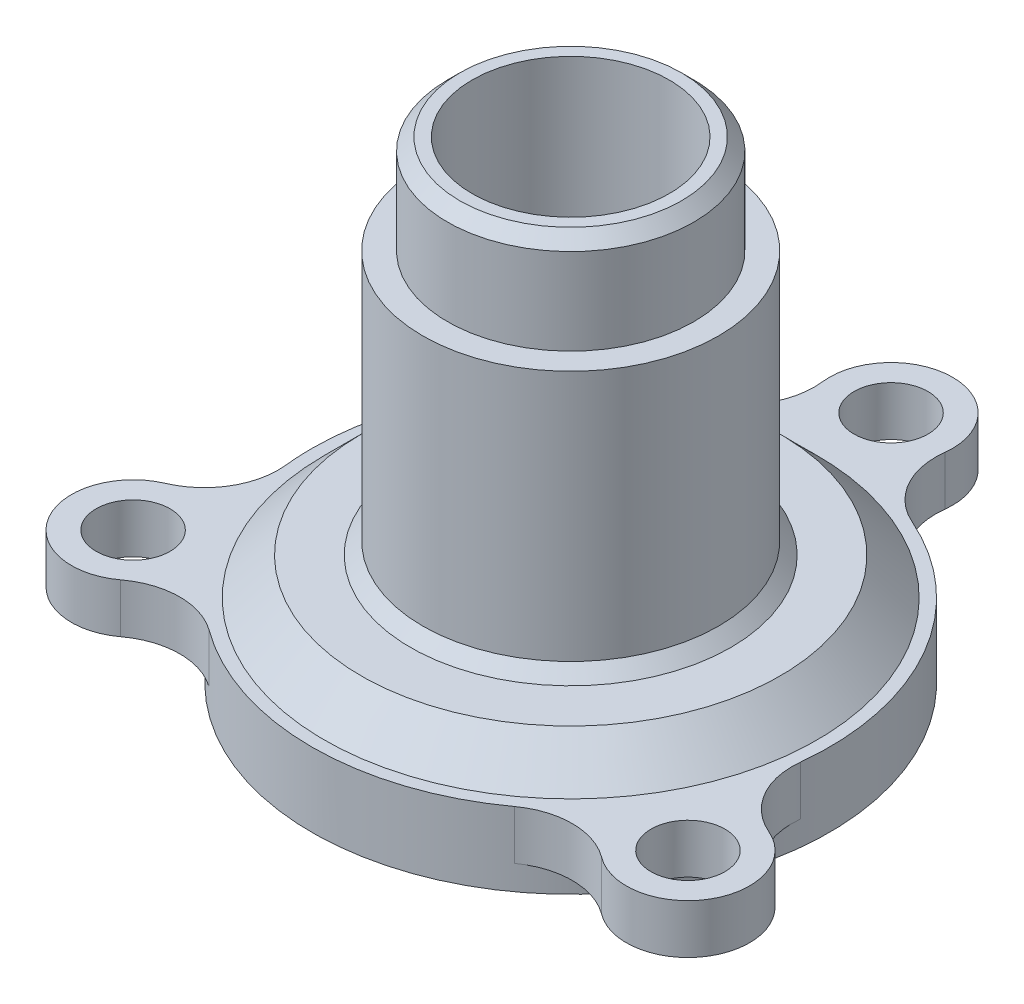
from build123d import *

# Parameters (mm, degrees)
CHAMFER_1_SIZE      = 0.5
SKETCH_2_R          = 1.5
CUT_EXTRUDE_1_DEPTH = 28.256925725


with BuildPart() as part:
    # 草图1 → 旋转1 (revolve)
    with BuildSketch(Plane.XY, mode=Mode.PRIVATE) as revolve_1_sk:
        Polygon((10.5, 0), (15.5, 0), (15.5, 2), (10, 2), (8.5, 3.5), (6, 3.5), (6, 14.2), (5, 14.2), (5, 18.2), (4, 18.2), (4, 1.5), (8.5, 1.5), (9.5, 0.5), (9.5, -1), (10.5, -1), align=None)
    revolve(revolve_1_sk.sketch.rotate(Axis((0, 18.9, 0), (0, -1, 0)), 180), axis=Axis((0, 18.9, 0), (0, -1, 0)))

    # 倒角1
    chamfer_1_edges = [part.edges().sort_by_distance(p)[0] for p in [
        (5, 18.2, 0),
        (6, 3.5, 0),
    ]]
    chamfer(chamfer_1_edges, length=CHAMFER_1_SIZE)

    # 草图2 → 切除-拉伸1 (cut, through all)
    with BuildSketch(Plane(origin=(0, 2, 0), x_dir=(1, 0, 0), z_dir=(0, 1, 0))):
        with Locations(Location((0, 13, 0), (0, 0, 270))):
            Circle(SKETCH_2_R)
        with Locations(Location((11.258330249, -6.5, 0), (0, 0, 270))):
            Circle(SKETCH_2_R)
        with Locations(Location((-11.258330249, -6.5, 0), (0, 0, 270))):
            Circle(SKETCH_2_R)
        with BuildLine():
            ThreePointArc((13.423393657, -7.750000175), (13.423393809, 7.749999912), (0, 15.5))
            ThreePointArc((0, 15.5), (1.86989398, 14.659366296), (2.482271238, 12.702797203))
            ThreePointArc((2.482271238, 12.702797203), (2.853955321, 10.861790304), (4.247441896, 9.602564103))
            ThreePointArc((4.247441896, 9.602564103), (9.09326674, 5.25), (10.439785402, -1.122889469))
            ThreePointArc((10.439785402, -1.122889469), (10.833563994, -2.959297343), (12.242080696, -4.20168865))
            ThreePointArc((12.242080696, -4.20168865), (13.630330638, -5.710307555), (13.423393657, -7.750000175))
        make_face()
        with BuildLine():
            ThreePointArc((-2.482271238, 12.702797203), (-1.86989398, 14.659366296), (0, 15.5))
            ThreePointArc((0, 15.5), (-13.42339379, 7.749999945), (-13.423393696, -7.750000109))
            ThreePointArc((-13.423393696, -7.750000109), (-13.630330625, -5.710307519), (-12.242080696, -4.20168865))
            ThreePointArc((-12.242080696, -4.20168865), (-10.833563994, -2.959297343), (-10.439785402, -1.122889469))
            ThreePointArc((-10.439785402, -1.122889469), (-9.09326674, 5.25), (-4.247441896, 9.602564103))
            ThreePointArc((-4.247441896, 9.602564103), (-2.853955321, 10.861790304), (-2.482271238, 12.702797203))
        make_face()
        with BuildLine():
            ThreePointArc((-13.423393696, -7.750000109), (-3.8e-08, -15.5), (13.423393657, -7.750000175))
            ThreePointArc((13.423393657, -7.750000175), (11.760436526, -8.949058857), (9.759809458, -8.501108552))
            ThreePointArc((9.759809458, -8.501108552), (7.979608673, -7.902492961), (6.192343507, -8.479674634))
            ThreePointArc((6.192343507, -8.479674634), (0, -10.5), (-6.192343507, -8.479674634))
            ThreePointArc((-6.192343507, -8.479674634), (-7.979608673, -7.902492961), (-9.759809458, -8.501108552))
            ThreePointArc((-9.759809458, -8.501108552), (-11.760436564, -8.94905885), (-13.423393696, -7.750000109))
        make_face()
    extrude(amount=-CUT_EXTRUDE_1_DEPTH, mode=Mode.SUBTRACT)


solid = part.part
